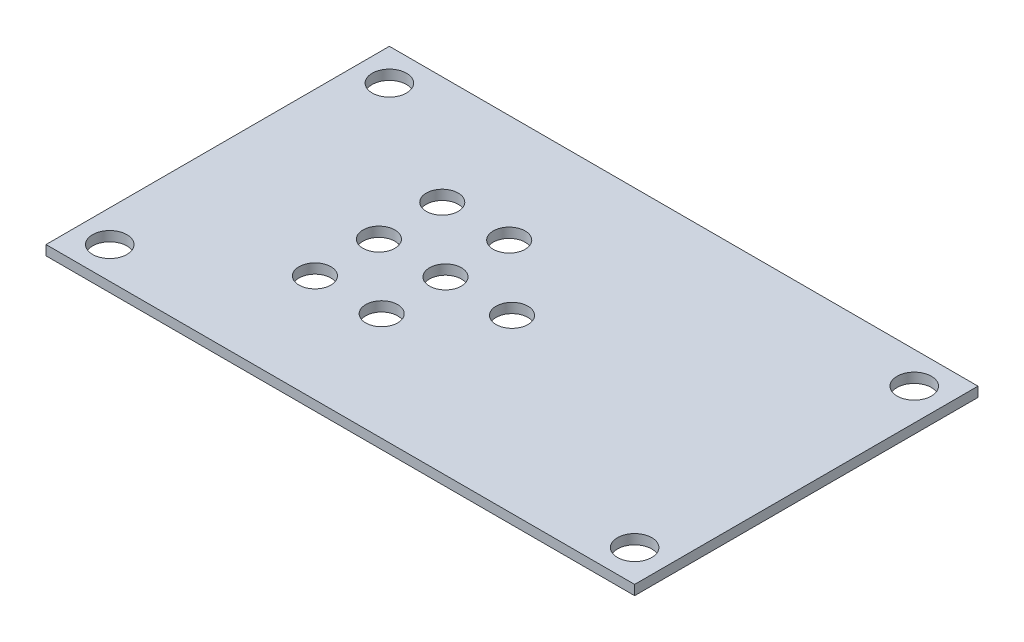
from build123d import *

# Parameters (mm, degrees)
SKETCH1_W           = 120
SKETCH1_H           = 70
BOSS_EXTRUDE1_DEPTH = 2
SKETCH3_R           = 3.5
CUT_EXTRUDE1_DEPTH  = 3
SKETCH6_R           = 2
BOSS_EXTRUDE2_DEPTH = 11
SKETCH4_R           = 3.25
CUT_EXTRUDE2_DEPTH  = 11


with BuildPart() as part:
    # Sketch1 → Boss-Extrude1 (new body)
    with BuildSketch(Plane(origin=(0, 0, 0), x_dir=(1, 0, 0), z_dir=(0, 1, 0))):
        Rectangle(SKETCH1_W, SKETCH1_H)
    extrude(amount=BOSS_EXTRUDE1_DEPTH)

    # Sketch3 → Cut-Extrude1 (cut)
    with BuildSketch(Plane(origin=(0, 2, 0), x_dir=(1, 0, 0), z_dir=(0, 1, 0))):
        with Locations(Location((-53.5, 28.5, 0), (0, 0, 270))):
            Circle(SKETCH3_R)
        with Locations(Location((53.5, 28.5, 0), (0, 0, 270))):
            Circle(SKETCH3_R)
        with Locations(Location((-53.5, -28.5, 0), (0, 0, 270))):
            Circle(SKETCH3_R)
        with Locations(Location((53.5, -28.5, 0), (0, 0, 270))):
            Circle(SKETCH3_R)
    extrude(amount=-CUT_EXTRUDE1_DEPTH, mode=Mode.SUBTRACT)

    # Sketch6 → Boss-Extrude2 (add)
    with BuildSketch(Plane(origin=(0, 2, 0), x_dir=(1, 0, 0), z_dir=(0, 1, 0))):
        with Locations(Location((0, -13, 0), (0, 0, 270))):
            Circle(SKETCH6_R)
        with Locations(Location((0, 13, 0), (0, 0, 270))):
            Circle(SKETCH6_R)
    extrude(amount=-BOSS_EXTRUDE2_DEPTH)

    # Sketch4 → Cut-Extrude2 (cut)
    with BuildSketch(Plane(origin=(0, 2, 0), x_dir=(1, 0, 0), z_dir=(0, 1, 0))):
        with Locations(Location((-27.054448087, -13.122273409, 0), (0, 0, 270))):
            Circle(SKETCH4_R)
        with Locations(Location((-27.023483048, -0.10764713, 0), (0, 0, 270))):
            Circle(SKETCH4_R)
        with Locations(Location((-27.081562274, 12.864019897, 0), (0, 0, 270))):
            Circle(SKETCH4_R)
        with Locations(Location((-13.567081484, 0, 0), (0, 0, 270))):
            Circle(SKETCH4_R)
        with Locations(Location((-13.567081484, -13, 0), (0, 0, 270))):
            Circle(SKETCH4_R)
        with Locations(Location((-13.567081484, 13, 0), (0, 0, 270))):
            Circle(SKETCH4_R)
        with Locations(Location((0, 0, 0), (0, 0, 270))):
            Circle(SKETCH4_R)
    extrude(amount=-CUT_EXTRUDE2_DEPTH, mode=Mode.SUBTRACT)


solid = part.part
